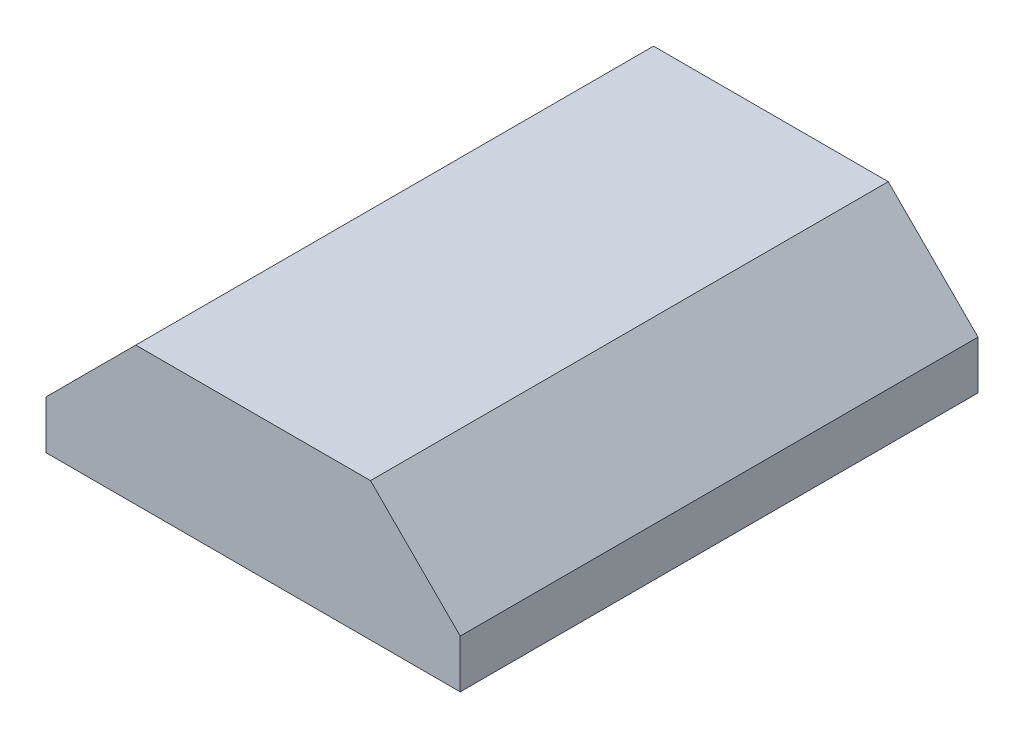
from build123d import *

# Parameters (mm, degrees)
AUFSATZ_LINEAR_AUSTRAGEN1_DEPTH = 15


with BuildPart() as part:
    # Skizze1 → Aufsatz-Linear austragen1 (new body)
    with BuildSketch(Plane.XY):
        Polygon((3.4, 1.808858787), (-3.4, 1.808858787), (-6, -0.791141213), (-6, -2.191141213), (6, -2.191141213), (6, -0.791141213), align=None)
    extrude(amount=AUFSATZ_LINEAR_AUSTRAGEN1_DEPTH)


solid = part.part
